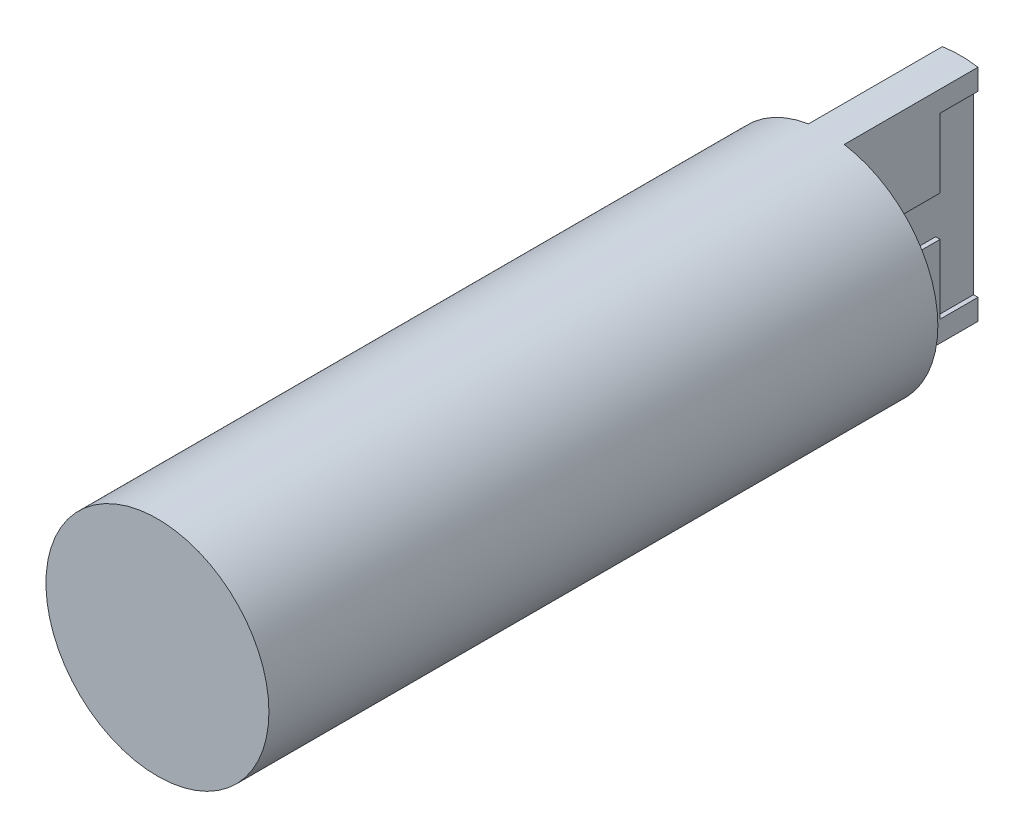
from build123d import *

# Parameters (mm, degrees)
ESQUISSE1_R             = 25
BOSS_EXTRU_1_DEPTH      = 150
BOSS_EXTRU_2_START      = 30
BOSS_EXTRU_2_DEPTH      = 30
ESQUISSE3_R             = 4
BOSS_EXTRU_3_DEPTH      = 9
BOSS_EXTRU_3_TAPER      = 1
ENL_V_MAT_EXTRU_1_DEPTH = 1


with BuildPart() as part:
    # Esquisse1 → Boss.-Extru.1 (new body)
    with BuildSketch(Plane.XY):
        Circle(ESQUISSE1_R)
    extrude(amount=BOSS_EXTRU_1_DEPTH)

    # Esquisse2 → Boss.-Extru.2 (add)
    with BuildSketch(Plane(origin=(0, 0, 0), x_dir=(-1, 0, 0), z_dir=(0, 0, -1)).offset(BOSS_EXTRU_2_START)):
        with BuildLine():
            Line((-4, -24.677925359), (-4, 24.677925359))
            ThreePointArc((-4, 24.677925359), (0, 25), (4, 24.677925359))
            Line((4, 24.677925359), (4, -24.677925359))
            ThreePointArc((4, -24.677925359), (0, -25), (-4, -24.677925359))
        make_face()
    extrude(amount=-BOSS_EXTRU_2_DEPTH)

    # Esquisse3 → Boss.-Extru.3 (add)
    with BuildSketch(Plane.ZY.offset(4)):
        with Locations((-26, 0)):
            Circle(ESQUISSE3_R)
    extrude(amount=BOSS_EXTRU_3_DEPTH, taper=BOSS_EXTRU_3_TAPER)

    # Esquisse4 → Enlèv. mat.-Extru.1 (cut)
    with BuildSketch(Plane(origin=(4, 0, 0), x_dir=(0, 0, -1), z_dir=(1, 0, 0))):
        Polygon((21.5, 4.5), (21.5, 20), (30.5, 20), (30.5, 4.5), (30, 4.5), (30, -4.5), (30.5, -4.5), (30.5, -20), (21.5, -20), (21.5, -4.5), (6, -4.5), (6, 4.5), align=None)
    extrude(amount=-ENL_V_MAT_EXTRU_1_DEPTH, mode=Mode.SUBTRACT)


solid = part.part
